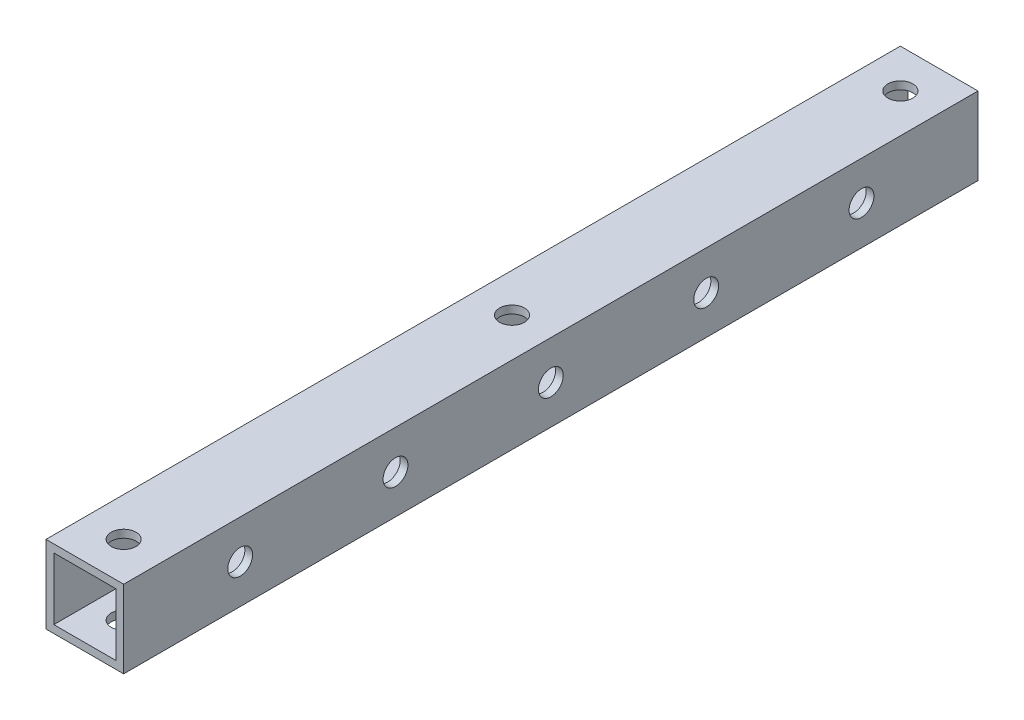
from build123d import *

# Parameters (mm, degrees)
SKETCH1_W           = 10
SKETCH1_H           = 10
BOSS_EXTRUDE1_DEPTH = 55
SKETCH2_W           = 8
SKETCH2_H           = 8
CUT_EXTRUDE1_DEPTH  = 110
SKETCH4_R           = 1.6
CUT_EXTRUDE2_DEPTH  = 10
SKETCH3_R           = 1.6
CUT_EXTRUDE3_DEPTH  = 10


with BuildPart() as part:
    # Sketch1 → Boss-Extrude1 (new body)
    with BuildSketch(Plane.XY):
        with Locations((-26.52173913, 10.217391304)):
            Rectangle(SKETCH1_W, SKETCH1_H)
    boss_extrude1 = extrude(amount=BOSS_EXTRUDE1_DEPTH)

    # Sketch2 → Cut-Extrude1 (cut)
    with BuildSketch(Plane.XY.offset(55)):
        with Locations((-26.517415058, 10.213067232)):
            Rectangle(SKETCH2_W, SKETCH2_H)
    cut_extrude1 = extrude(amount=-CUT_EXTRUDE1_DEPTH, mode=Mode.SUBTRACT)

    # Sketch4 → Cut-Extrude2 (cut)
    with BuildSketch(Plane(origin=(-21.52173913, 0, 0), x_dir=(0, 0, -1), z_dir=(1, 0, 0))):
        with Locations((-15, 10.217391304)):
            Circle(SKETCH4_R)
        with Locations((-35, 10.217391304)):
            Circle(SKETCH4_R)
        with Locations((-55, 10.217391304)):
            Circle(SKETCH4_R)
    cut_extrude2 = extrude(amount=-CUT_EXTRUDE2_DEPTH, mode=Mode.SUBTRACT)

    # Sketch3 → Cut-Extrude3 (cut)
    with BuildSketch(Plane(origin=(0, 15.217391304, 0), x_dir=(1, 0, 0), z_dir=(0, 1, 0))):
        with BuildLine():
            Line((-28.12173913, -55), (-24.92173913, -55))
            ThreePointArc((-24.92173913, -55), (-26.52173913, -53.4), (-28.12173913, -55))
        make_face()
        with BuildLine():
            ThreePointArc((-28.12173913, -55), (-26.52173913, -56.6), (-24.92173913, -55))
            Line((-24.92173913, -55), (-28.12173913, -55))
        make_face()
        with Locations(Location((-26.52173913, -5, 0), (0, 0, 270))):
            Circle(SKETCH3_R)
    cut_extrude3 = extrude(amount=-CUT_EXTRUDE3_DEPTH, mode=Mode.SUBTRACT)

    # Mirror1: Boss-Extrude1, Cut-Extrude1, Cut-Extrude2, Cut-Extrude3 across plane
    add(boss_extrude1.mirror(Plane.XY.offset(55)))
    add(cut_extrude1.mirror(Plane.XY.offset(55)), mode=Mode.SUBTRACT)
    add(cut_extrude2.mirror(Plane.XY.offset(55)), mode=Mode.SUBTRACT)
    add(cut_extrude3.mirror(Plane.XY.offset(55)), mode=Mode.SUBTRACT)


solid = part.part
